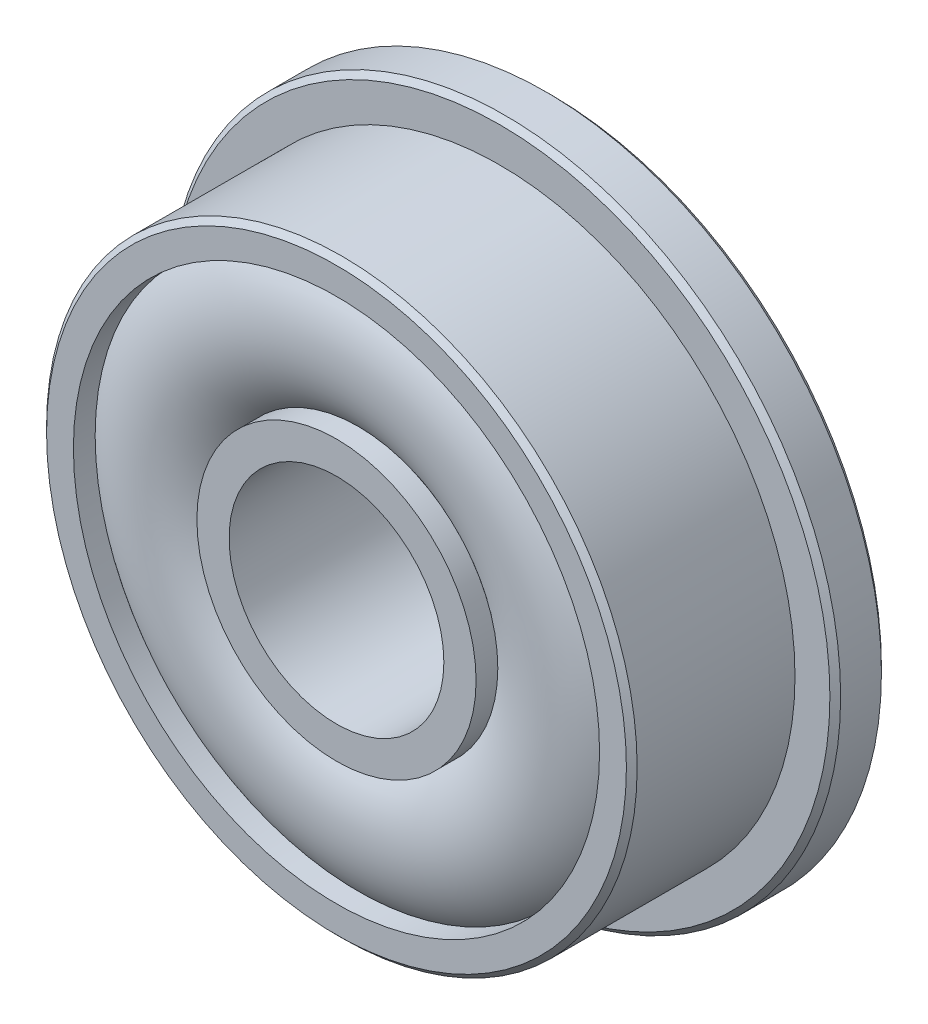
from build123d import *

# Parameters (mm, degrees)
CHAMFER1_SIZE = 0.1


with BuildPart() as part:
    # Sketch1 → Revolve1 (revolve)
    with BuildSketch(Plane(origin=(0, 0, 0), x_dir=(0, 0, -1), z_dir=(1, 0, 0)), mode=Mode.PRIVATE) as revolve1_sk:
        with BuildLine():
            Line((-2, 2), (2, 2))
            Line((2, 2), (2, 2.6))
            Line((2, 2.6), (1.594951068, 2.6))
            ThreePointArc((1.594951068, 2.6), (2, 3.75), (1.594951068, 4.9))
            Line((1.594951068, 4.9), (2, 4.9))
            Line((2, 4.9), (2, 6.25))
            Line((2, 6.25), (1.04, 6.25))
            Line((1.04, 6.25), (1.04, 5.5))
            Line((1.04, 5.5), (-2, 5.5))
            Line((-2, 5.5), (-2, 4.9))
            Line((-2, 4.9), (-1.594951068, 4.9))
            ThreePointArc((-1.594951068, 4.9), (-2, 3.75), (-1.594951068, 2.6))
            Line((-1.594951068, 2.6), (-2, 2.6))
            Line((-2, 2.6), (-2, 2))
        make_face()
    revolve(revolve1_sk.sketch.rotate(Axis((0, 0, 0), (0, 0, -1)), 90), axis=Axis((0, 0, 0), (0, 0, -1)))

    # Chamfer1
    chamfer1_edges = [part.edges().sort_by_distance(p)[0] for p in [
        (-5.5, 0, 2),
        (-6.25, 0, -1.04),
        (-6.25, 0, -2),
    ]]
    chamfer(chamfer1_edges, length=CHAMFER1_SIZE)


solid = part.part
